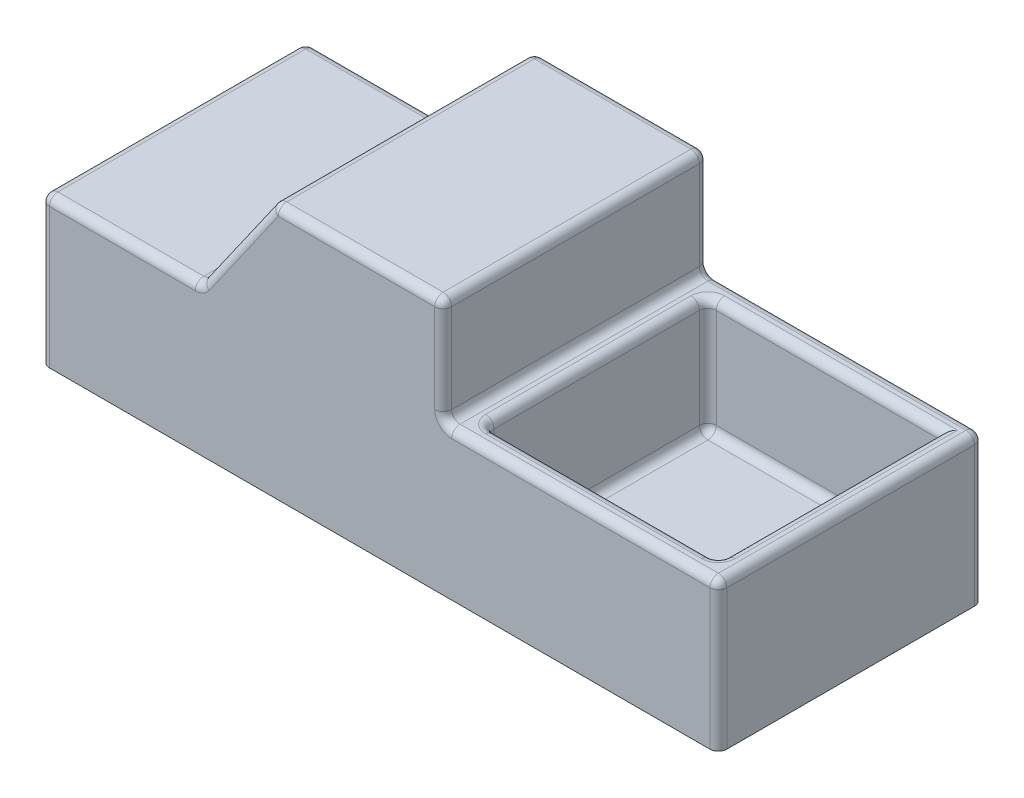
from build123d import *

# Parameters (mm, degrees)
BOSS_EXTRUDE1_DEPTH = 158.75
SKETCH2_W           = 279.4
SKETCH2_H           = 266.7
CUT_EXTRUDE1_DEPTH  = 139.7
FILLET1_R           = 10.16


with BuildPart() as part:
    # Sketch1 → Boss-Extrude1 (new, symmetric)
    with BuildSketch(Plane.XY):
        Polygon((-406.4, 88.9), (-406.4, -88.9), (406.4, -88.9), (406.4, 88.9), (76.2, 88.9), (76.2, 215.9), (-126.973642647, 215.9), (-215.9, 88.9), align=None)
    extrude(amount=BOSS_EXTRUDE1_DEPTH, both=True)

    # Sketch2 → Cut-Extrude1 (cut)
    with BuildSketch(Plane(origin=(0, 88.9, 0), x_dir=(1, 0, 0), z_dir=(0, 1, 0))):
        with Locations((241.3, 0)):
            Rectangle(SKETCH2_W, SKETCH2_H)
    extrude(amount=-CUT_EXTRUDE1_DEPTH, mode=Mode.SUBTRACT)

    # Fillet1
    fillet1_edges = [part.edges().sort_by_distance(p)[0] for p in [
        (406.4, 0, -158.75),
        (-406.4, 0, -158.75),
        (-311.15, 88.9, -158.75),
        (-215.9, 88.9, 0),
        (-126.973642647, 215.9, 0),
        (76.2, 215.9, 0),
        (76.2, 88.9, 0),
        (406.4, 88.9, 0),
        (-406.4, 88.9, 0),
        (406.4, 0, 158.75),
        (241.3, 88.9, 158.75),
        (76.2, 152.4, 158.75),
        (101.6, -50.8, 0),
        (101.6, 19.05, 133.35),
        (241.3, -50.8, -133.35),
        (101.6, 19.05, -133.35),
        (381, -50.8, 0),
        (241.3, -50.8, 133.35),
        (-25.386821324, 215.9, 158.75),
        (381, 19.05, 133.35),
        (101.6, 88.9, 0),
        (241.3, 88.9, 133.35),
        (381, 88.9, 0),
        (241.3, 88.9, -133.35),
        (-171.436821324, 152.4, 158.75),
        (-311.15, 88.9, 158.75),
        (-171.436821324, 152.4, -158.75),
        (-406.4, 0, 158.75),
        (-25.386821324, 215.9, -158.75),
        (76.2, 152.4, -158.75),
        (241.3, 88.9, -158.75),
    ]]
    fillet(fillet1_edges, radius=FILLET1_R)


solid = part.part
